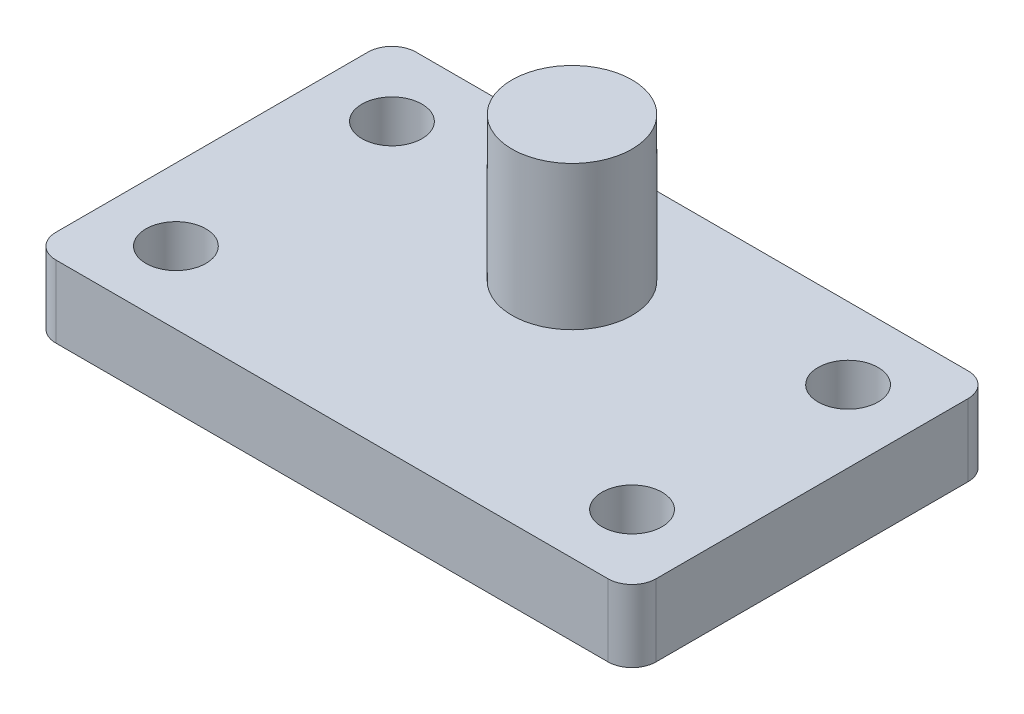
from build123d import *

# Parameters (mm, degrees)
Y_KSEKLIK_EKSTR_ZYON1_DEPTH = 30
IZIM2_R                     = 25
Y_KSEKLIK_EKSTR_ZYON2_DEPTH = 60
IZIM3_R                     = 12.5
KES_EKSTR_ZYON1_DEPTH       = 158.638827704
L_O_ALTMA2_COUNT            = 2
L_O_ALTMA2_PITCH            = 190
L_O_ALTMA2_COUNT_DIR2       = 2
L_O_ALTMA2_PITCH_DIR2       = 90


with BuildPart() as part:
    # Çizim1 → Yükseklik-Ekstrüzyon1 (new body)
    with BuildSketch(Plane(origin=(0, 0, 0), x_dir=(1, 0, 0), z_dir=(0, 1, 0))):
        with BuildLine():
            Line((-115, 75), (115, 75))
            ThreePointArc((115, 75), (122.071067812, 72.071067812), (125, 65))
            Line((125, 65), (125, -65))
            ThreePointArc((125, -65), (122.071067812, -72.071067812), (115, -75))
            Line((115, -75), (-115, -75))
            ThreePointArc((-115, -75), (-122.071067812, -72.071067812), (-125, -65))
            Line((-125, -65), (-125, 65))
            ThreePointArc((-125, 65), (-122.071067812, 72.071067812), (-115, 75))
        make_face()
    extrude(amount=-Y_KSEKLIK_EKSTR_ZYON1_DEPTH)

    # Çizim2 → Yükseklik-Ekstrüzyon2 (add)
    with BuildSketch(Plane(origin=(0, 0, 0), x_dir=(1, 0, 0), z_dir=(0, 1, 0))):
        with Locations(Location((0, 25, 0), (0, 0, 90))):
            Circle(IZIM2_R)
    extrude(amount=Y_KSEKLIK_EKSTR_ZYON2_DEPTH)

    # Çizim3 → Kes-Ekstrüzyon1 (cut, through all)
    with BuildSketch(Plane(origin=(0, 0, 0), x_dir=(1, 0, 0), z_dir=(0, 1, 0))):
        with Locations(Location((-95, 45, 0), (0, 0, 270))):
            Circle(IZIM3_R)
    kes_ekstr_zyon1 = extrude(amount=-KES_EKSTR_ZYON1_DEPTH, mode=Mode.SUBTRACT)

    # LÇoğaltma2: Kes-Ekstr_zyon1 2 × 2
    with Locations(*[(i * L_O_ALTMA2_PITCH, 0, j * L_O_ALTMA2_PITCH_DIR2) for i in range(L_O_ALTMA2_COUNT) for j in range(L_O_ALTMA2_COUNT_DIR2) if (i, j) != (0, 0)]):
        add(kes_ekstr_zyon1, mode=Mode.SUBTRACT)


solid = part.part
